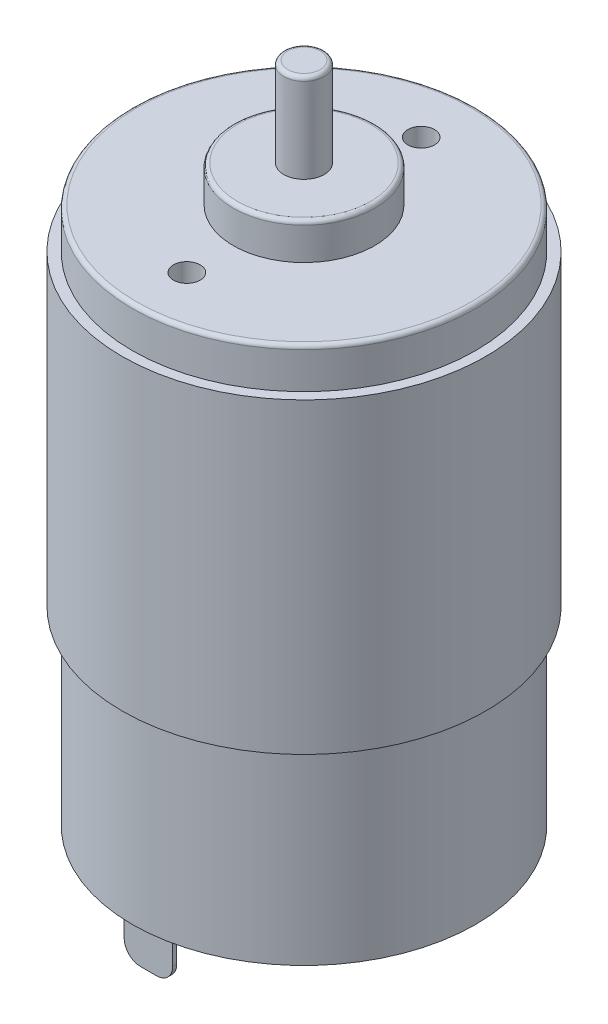
from build123d import *

# Parameters (mm, degrees)
SKETCH_2_W          = 6
SKETCH_2_H          = 0.5
EXTRUDE_1_DEPTH     = 6
SKETCH_3_R          = 1.65
CUT_EXTRUDE_1_DEPTH = 3.5
FILLET_1_R          = 0.5
FILLET_2_R          = 2


with BuildPart() as part:
    # Эскиз1 → Повернуть1 (revolve)
    with BuildSketch(Plane.XY, mode=Mode.PRIVATE) as revolve_1_sk:
        Polygon((0, 0), (0, 93.5), (2.5, 93.5), (2.5, 82.5), (8.75, 82.5), (8.75, 78), (21.25, 78), (21.25, 73), (22.5, 73), (22.5, 35), (21.25, 35), (21.25, 11.5), (8.75, 11.5), (8.75, 7.5), (2.5, 7.5), (2.5, 0), align=None)
    revolve(revolve_1_sk.sketch.rotate(Axis((0, 0, 0), (0, 1, 0)), 90), axis=Axis((0, 0, 0), (0, 1, 0)))

    # Эскиз2 → Бобышка-Вытянуть1 (add)
    with BuildSketch(Plane.XZ.offset(-11.5)):
        with Locations((0, -19)):
            Rectangle(SKETCH_2_W, SKETCH_2_H)
        with Locations((0, 19)):
            Rectangle(SKETCH_2_W, SKETCH_2_H)
    extrude(amount=EXTRUDE_1_DEPTH)

    # Эскиз3 → Вырез-Вытянуть1 (cut)
    with BuildSketch(Plane(origin=(0, 78, 0), x_dir=(1, 0, 0), z_dir=(0, 1, 0))):
        with Locations(Location((0, -14.5, 0), (0, 0, 270))):
            Circle(SKETCH_3_R)
        with Locations(Location((0, 14.5, 0), (0, 0, 270))):
            Circle(SKETCH_3_R)
    extrude(amount=-CUT_EXTRUDE_1_DEPTH, mode=Mode.SUBTRACT)

    # Скругление1
    fillet_1_edges = [part.edges().sort_by_distance(p)[0] for p in [
        (0, 0, 2.5),
        (0, 7.5, 8.75),
        (0, 78, 21.25),
        (0, 82.5, 8.75),
        (0, 93.5, 2.5),
    ]]
    fillet(fillet_1_edges, radius=FILLET_1_R)

    # Скругление2
    fillet_2_edges = [part.edges().sort_by_distance(p)[0] for p in [
        (-3, 5.5, 19),
        (3, 5.5, 19),
        (-3, 5.5, -19),
        (3, 5.5, -19),
    ]]
    fillet(fillet_2_edges, radius=FILLET_2_R)


solid = part.part
